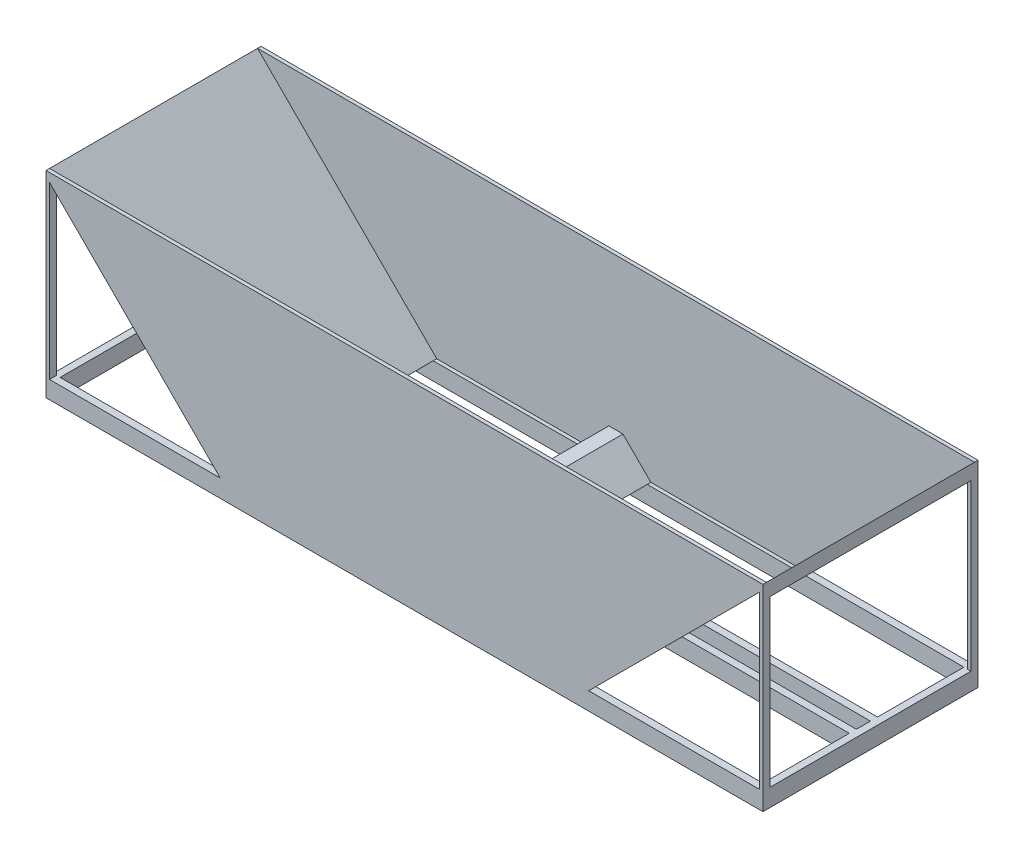
from build123d import *

# Parameters (mm, degrees)
BOSS_EXTRUDE1_DEPTH      = 10
BOSS_EXTRUDE1_DEPTH_BACK = 15
SKETCH1_W                = 1016
SKETCH1_H                = 304.8
SKETCH1_W_2              = 996
SKETCH1_H_2              = 284.8
BOSS_EXTRUDE2_DEPTH      = 10
BOSS_EXTRUDE2_DEPTH_BACK = 15
BOSS_EXTRUDE3_DEPTH      = 152.4
BOSS_EXTRUDE3_DEPTH_BACK = 152.4
SKETCH4_W                = 507.049279033
SKETCH4_H                = 40
BOSS_EXTRUDE7_DEPTH      = 5
SKETCH5_W                = 284.8
SKETCH5_H                = 234
CUT_EXTRUDE1_DEPTH       = 15
SKETCH6_W                = 284.8
SKETCH6_H                = 234
CUT_EXTRUDE2_DEPTH       = 15
BOSS_EXTRUDE8_DEPTH      = 304.8
BOSS_EXTRUDE9_DEPTH      = 5
BOSS_EXTRUDE10_DEPTH     = 5


with BuildPart() as part:
    # Sketch1 → Boss-Extrude1 (new, two sides: drawn at the far end of the back side and taken through both)
    with BuildSketch(Plane(origin=(0, 0, 0), x_dir=(1, 0, 0), z_dir=(0, 1, 0)).offset(-BOSS_EXTRUDE1_DEPTH_BACK)):
        Rectangle(SKETCH1_W, SKETCH1_H)
        Rectangle(SKETCH1_W_2, SKETCH1_H_2, mode=Mode.SUBTRACT)
    extrude(amount=BOSS_EXTRUDE1_DEPTH + BOSS_EXTRUDE1_DEPTH_BACK)

    # Sketch2 → Boss-Extrude2 (add, two sides: drawn at the far end of the back side and taken through both)
    with BuildSketch(Plane(origin=(0, 0, 0), x_dir=(1, 0, 0), z_dir=(0, 1, 0)).offset(-BOSS_EXTRUDE2_DEPTH_BACK)):
        with BuildLine():
            Line((-498, 20), (-30, 20))
            ThreePointArc((-30, 20), (-22.928932188, 22.928932188), (-20, 30))
            Line((-20, 30), (-20, 142.4))
            Line((-20, 142.4), (-10, 142.4))
            Line((-10, 142.4), (-10, 20))
            Line((-10, 20), (-10, 10))
            Line((-10, 10), (-498, 10))
            Line((-498, 10), (-498, 20))
        make_face()
        with BuildLine():
            Line((498, 20), (498, 10))
            Line((498, 10), (10, 10))
            Line((10, 10), (10, 20))
            Line((10, 20), (10, 142.4))
            Line((10, 142.4), (20, 142.4))
            Line((20, 142.4), (20, 30))
            ThreePointArc((20, 30), (22.928932188, 22.928932188), (30, 20))
            Line((30, 20), (498, 20))
        make_face()
        with BuildLine():
            Line((-498, -10), (-10, -10))
            Line((-10, -10), (-10, -20))
            Line((-10, -20), (-10, -142.4))
            Line((-10, -142.4), (-20, -142.4))
            Line((-20, -142.4), (-20, -30))
            ThreePointArc((-20, -30), (-22.928932188, -22.928932188), (-30, -20))
            Line((-30, -20), (-498, -20))
            Line((-498, -20), (-498, -10))
        make_face()
        with BuildLine():
            Line((30, -20), (498, -20))
            Line((498, -20), (498, -10))
            Line((498, -10), (10, -10))
            Line((10, -10), (10, -20))
            Line((10, -20), (10, -142.4))
            Line((10, -142.4), (20, -142.4))
            Line((20, -142.4), (20, -30))
            ThreePointArc((20, -30), (22.928932188, -22.928932188), (30, -20))
        make_face()
    extrude(amount=BOSS_EXTRUDE2_DEPTH + BOSS_EXTRUDE2_DEPTH_BACK)

    # Sketch3 → Boss-Extrude3 (add, two sides: drawn at the far end of the back side and taken through both)
    with BuildSketch(Plane.XY.offset(-BOSS_EXTRUDE3_DEPTH_BACK)):
        Polygon((-508, 10), (-508, 264), (-254, 10), (-261.071067812, 10), (-503, 251.928932188), (-503, 10), align=None)
        Polygon((261.071067812, 10), (254, 10), (508, 264), (508, 10), (503, 10), (503, 251.928932188), align=None)
    extrude(amount=BOSS_EXTRUDE3_DEPTH + BOSS_EXTRUDE3_DEPTH_BACK)

    # Sketch4 → Boss-Extrude7 (add)
    with BuildSketch(Plane(origin=(0, 10, 0), x_dir=(1, 0, 0), z_dir=(0, 1, 0))):
        with Locations((-0.42499269, 0)):
            Rectangle(SKETCH4_W, SKETCH4_H)
    extrude(amount=BOSS_EXTRUDE7_DEPTH)

    # Sketch5 → Cut-Extrude1 (cut)
    with BuildSketch(Plane(origin=(508, 0, 0), x_dir=(0, 0, -1), z_dir=(1, 0, 0))):
        with Locations((0, 127)):
            Rectangle(SKETCH5_W, SKETCH5_H)
    extrude(amount=-CUT_EXTRUDE1_DEPTH, mode=Mode.SUBTRACT)

    # Sketch6 → Cut-Extrude2 (cut)
    with BuildSketch(Plane.ZY.offset(508)):
        with Locations((0, 127)):
            Rectangle(SKETCH6_W, SKETCH6_H)
    extrude(amount=-CUT_EXTRUDE2_DEPTH, mode=Mode.SUBTRACT)

    # Sketch7 → Boss-Extrude8 (add)
    with BuildSketch(Plane(origin=(0, 0, -152.4), x_dir=(-1, 0, 0), z_dir=(0, 0, -1))):
        Polygon((-49.38581657, 10), (-9.847908285, 49.537908285), (10.152091715, 49.537908285), (49.69, 10), align=None)
    extrude(amount=-BOSS_EXTRUDE8_DEPTH)

    # Sketch8 → Boss-Extrude9 (add)
    with BuildSketch(Plane.XY.offset(152.4)):
        Polygon((-508, 264), (508, 264), (254, 10), (-254, 10), align=None)
    extrude(amount=-BOSS_EXTRUDE9_DEPTH)

    # Sketch9 → Boss-Extrude10 (add)
    with BuildSketch(Plane(origin=(0, 0, -152.4), x_dir=(-1, 0, 0), z_dir=(0, 0, -1))):
        Polygon((-508, 264), (508, 264), (254, 10), (-254, 10), align=None)
    extrude(amount=-BOSS_EXTRUDE10_DEPTH)


solid = part.part
